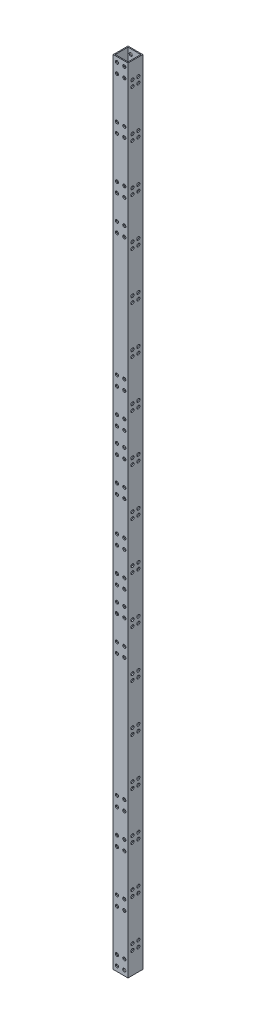
from build123d import *

# Parameters (mm, degrees)
SKETCH_1_W          = 15
SKETCH_1_H          = 15
SKETCH_1_W_2        = 13
SKETCH_1_H_2        = 13
EXTRUDE_1_DEPTH     = 805
SKETCH_2_R          = 1.6
CUT_EXTRUDE_1_DEPTH = 15
SKETCH_3_R          = 1.6
CUT_EXTRUDE_2_DEPTH = 15


with BuildPart() as part:
    # 草图1 → 凸台-拉伸1 (new body)
    with BuildSketch(Plane(origin=(0, 0, 0), x_dir=(1, 0, 0), z_dir=(0, 1, 0))):
        Rectangle(SKETCH_1_W, SKETCH_1_H)
        Rectangle(SKETCH_1_W_2, SKETCH_1_H_2, mode=Mode.SUBTRACT)
    extrude(amount=EXTRUDE_1_DEPTH)

    # 草图2 → 切除-拉伸1 (cut)
    with BuildSketch(Plane.XY.offset(7.5)):
        with Locations((-3.75, 747.5)):
            Circle(SKETCH_2_R)
        with Locations((3.75, 747.5)):
            Circle(SKETCH_2_R)
        with Locations((-3.75, 737.5)):
            Circle(SKETCH_2_R)
        with Locations((3.75, 737.5)):
            Circle(SKETCH_2_R)
        with Locations((3.75, 67.5)):
            Circle(SKETCH_2_R)
        with Locations((-3.75, 67.5)):
            Circle(SKETCH_2_R)
        with Locations((3.75, 57.5)):
            Circle(SKETCH_2_R)
        with Locations((-3.75, 57.5)):
            Circle(SKETCH_2_R)
        with Locations((-3.75, 695)):
            Circle(SKETCH_2_R)
        with Locations((3.75, 695)):
            Circle(SKETCH_2_R)
        with Locations((3.75, 685)):
            Circle(SKETCH_2_R)
        with Locations((-3.75, 685)):
            Circle(SKETCH_2_R)
        with Locations((-3.75, 660)):
            Circle(SKETCH_2_R)
        with Locations((3.75, 660)):
            Circle(SKETCH_2_R)
        with Locations((3.75, 650)):
            Circle(SKETCH_2_R)
        with Locations((-3.75, 650)):
            Circle(SKETCH_2_R)
        with Locations((-3.75, 155)):
            Circle(SKETCH_2_R)
        with Locations((3.75, 155)):
            Circle(SKETCH_2_R)
        with Locations((3.75, 145)):
            Circle(SKETCH_2_R)
        with Locations((-3.75, 145)):
            Circle(SKETCH_2_R)
        with Locations((-3.75, 120)):
            Circle(SKETCH_2_R)
        with Locations((3.75, 120)):
            Circle(SKETCH_2_R)
        with Locations((3.75, 110)):
            Circle(SKETCH_2_R)
        with Locations((-3.75, 110)):
            Circle(SKETCH_2_R)
        with Locations((-3.75, 800)):
            Circle(SKETCH_2_R)
        with Locations((3.75, 800)):
            Circle(SKETCH_2_R)
        with Locations((3.75, 790)):
            Circle(SKETCH_2_R)
        with Locations((-3.75, 790)):
            Circle(SKETCH_2_R)
        with Locations((-3.75, 15)):
            Circle(SKETCH_2_R)
        with Locations((3.75, 15)):
            Circle(SKETCH_2_R)
        with Locations((3.75, 5)):
            Circle(SKETCH_2_R)
        with Locations((-3.75, 5)):
            Circle(SKETCH_2_R)
        with Locations((-3.75, 290)):
            Circle(SKETCH_2_R)
        with Locations((3.75, 290)):
            Circle(SKETCH_2_R)
        with Locations((3.75, 280)):
            Circle(SKETCH_2_R)
        with Locations((-3.75, 280)):
            Circle(SKETCH_2_R)
        with Locations((-3.75, 325)):
            Circle(SKETCH_2_R)
        with Locations((3.75, 325)):
            Circle(SKETCH_2_R)
        with Locations((3.75, 315)):
            Circle(SKETCH_2_R)
        with Locations((-3.75, 315)):
            Circle(SKETCH_2_R)
        with Locations((-3.75, 490)):
            Circle(SKETCH_2_R)
        with Locations((3.75, 490)):
            Circle(SKETCH_2_R)
        with Locations((3.75, 480)):
            Circle(SKETCH_2_R)
        with Locations((-3.75, 480)):
            Circle(SKETCH_2_R)
        with Locations((-3.75, 525)):
            Circle(SKETCH_2_R)
        with Locations((3.75, 525)):
            Circle(SKETCH_2_R)
        with Locations((3.75, 515)):
            Circle(SKETCH_2_R)
        with Locations((-3.75, 515)):
            Circle(SKETCH_2_R)
        with Locations((-3.75, 464.8)):
            Circle(SKETCH_2_R)
        with Locations((3.75, 464.8)):
            Circle(SKETCH_2_R)
        with Locations((3.75, 454.8)):
            Circle(SKETCH_2_R)
        with Locations((-3.75, 454.8)):
            Circle(SKETCH_2_R)
        with Locations((-3.75, 429.8)):
            Circle(SKETCH_2_R)
        with Locations((3.75, 429.8)):
            Circle(SKETCH_2_R)
        with Locations((3.75, 419.8)):
            Circle(SKETCH_2_R)
        with Locations((-3.75, 419.8)):
            Circle(SKETCH_2_R)
        with Locations((-3.75, 385.2)):
            Circle(SKETCH_2_R)
        with Locations((3.75, 385.2)):
            Circle(SKETCH_2_R)
        with Locations((3.75, 375.2)):
            Circle(SKETCH_2_R)
        with Locations((-3.75, 375.2)):
            Circle(SKETCH_2_R)
        with Locations((-3.75, 350.2)):
            Circle(SKETCH_2_R)
        with Locations((3.75, 350.2)):
            Circle(SKETCH_2_R)
        with Locations((3.75, 340.2)):
            Circle(SKETCH_2_R)
        with Locations((-3.75, 340.2)):
            Circle(SKETCH_2_R)
    extrude(amount=-CUT_EXTRUDE_1_DEPTH, mode=Mode.SUBTRACT)

    # 草图3 → 切除-拉伸2 (cut)
    with BuildSketch(Plane.ZY.offset(7.5)):
        with Locations((-3, 788)):
            Circle(SKETCH_3_R)
        with Locations((3, 788)):
            Circle(SKETCH_3_R)
        with Locations((-3, 782)):
            Circle(SKETCH_3_R)
        with Locations((3, 782)):
            Circle(SKETCH_3_R)
        with Locations((-3, 740.5)):
            Circle(SKETCH_3_R)
        with Locations((-3, 734.5)):
            Circle(SKETCH_3_R)
        with Locations((3, 734.5)):
            Circle(SKETCH_3_R)
        with Locations((3, 740.5)):
            Circle(SKETCH_3_R)
        with Locations((-3, 693)):
            Circle(SKETCH_3_R)
        with Locations((-3, 687)):
            Circle(SKETCH_3_R)
        with Locations((3, 687)):
            Circle(SKETCH_3_R)
        with Locations((3, 693)):
            Circle(SKETCH_3_R)
        with Locations((-3, 645.5)):
            Circle(SKETCH_3_R)
        with Locations((-3, 639.5)):
            Circle(SKETCH_3_R)
        with Locations((3, 639.5)):
            Circle(SKETCH_3_R)
        with Locations((3, 645.5)):
            Circle(SKETCH_3_R)
        with Locations((-3, 598)):
            Circle(SKETCH_3_R)
        with Locations((-3, 592)):
            Circle(SKETCH_3_R)
        with Locations((3, 592)):
            Circle(SKETCH_3_R)
        with Locations((3, 598)):
            Circle(SKETCH_3_R)
        with Locations((-3, 550.5)):
            Circle(SKETCH_3_R)
        with Locations((-3, 544.5)):
            Circle(SKETCH_3_R)
        with Locations((3, 544.5)):
            Circle(SKETCH_3_R)
        with Locations((3, 550.5)):
            Circle(SKETCH_3_R)
        with Locations((-3, 503)):
            Circle(SKETCH_3_R)
        with Locations((-3, 497)):
            Circle(SKETCH_3_R)
        with Locations((3, 497)):
            Circle(SKETCH_3_R)
        with Locations((3, 503)):
            Circle(SKETCH_3_R)
        with Locations((-3, 455.5)):
            Circle(SKETCH_3_R)
        with Locations((-3, 449.5)):
            Circle(SKETCH_3_R)
        with Locations((3, 449.5)):
            Circle(SKETCH_3_R)
        with Locations((3, 455.5)):
            Circle(SKETCH_3_R)
        with Locations((-3, 408)):
            Circle(SKETCH_3_R)
        with Locations((-3, 402)):
            Circle(SKETCH_3_R)
        with Locations((3, 402)):
            Circle(SKETCH_3_R)
        with Locations((3, 408)):
            Circle(SKETCH_3_R)
        with Locations((-3, 360.5)):
            Circle(SKETCH_3_R)
        with Locations((-3, 354.5)):
            Circle(SKETCH_3_R)
        with Locations((3, 354.5)):
            Circle(SKETCH_3_R)
        with Locations((3, 360.5)):
            Circle(SKETCH_3_R)
        with Locations((-3, 313)):
            Circle(SKETCH_3_R)
        with Locations((-3, 307)):
            Circle(SKETCH_3_R)
        with Locations((3, 307)):
            Circle(SKETCH_3_R)
        with Locations((3, 313)):
            Circle(SKETCH_3_R)
        with Locations((-3, 265.5)):
            Circle(SKETCH_3_R)
        with Locations((-3, 259.5)):
            Circle(SKETCH_3_R)
        with Locations((3, 259.5)):
            Circle(SKETCH_3_R)
        with Locations((3, 265.5)):
            Circle(SKETCH_3_R)
        with Locations((-3, 218)):
            Circle(SKETCH_3_R)
        with Locations((-3, 212)):
            Circle(SKETCH_3_R)
        with Locations((3, 212)):
            Circle(SKETCH_3_R)
        with Locations((3, 218)):
            Circle(SKETCH_3_R)
        with Locations((-3, 170.5)):
            Circle(SKETCH_3_R)
        with Locations((-3, 164.5)):
            Circle(SKETCH_3_R)
        with Locations((3, 164.5)):
            Circle(SKETCH_3_R)
        with Locations((3, 170.5)):
            Circle(SKETCH_3_R)
        with Locations((-3, 123)):
            Circle(SKETCH_3_R)
        with Locations((-3, 117)):
            Circle(SKETCH_3_R)
        with Locations((3, 117)):
            Circle(SKETCH_3_R)
        with Locations((3, 123)):
            Circle(SKETCH_3_R)
        with Locations((-3, 75.5)):
            Circle(SKETCH_3_R)
        with Locations((-3, 69.5)):
            Circle(SKETCH_3_R)
        with Locations((3, 69.5)):
            Circle(SKETCH_3_R)
        with Locations((3, 75.5)):
            Circle(SKETCH_3_R)
        with Locations((-3, 28)):
            Circle(SKETCH_3_R)
        with Locations((-3, 22)):
            Circle(SKETCH_3_R)
        with Locations((3, 22)):
            Circle(SKETCH_3_R)
        with Locations((3, 28)):
            Circle(SKETCH_3_R)
    extrude(amount=-CUT_EXTRUDE_2_DEPTH, mode=Mode.SUBTRACT)


solid = part.part
